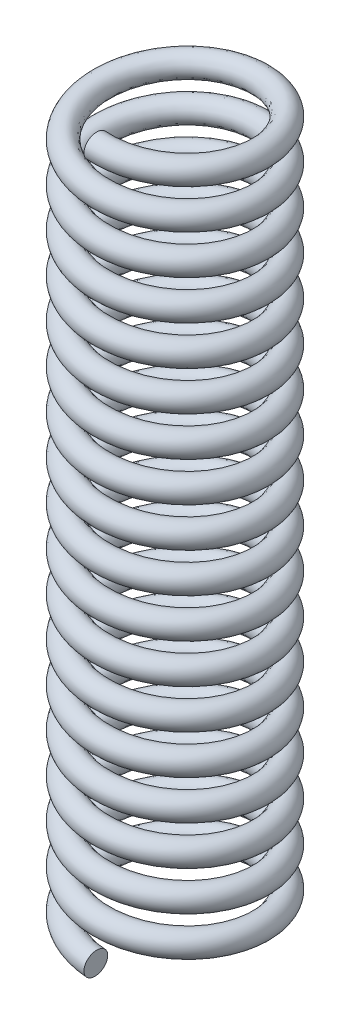
from build123d import *

# Parameters (mm, degrees)
COIL_WIRE_PITCH     = 1.988888889
COIL_WIRE_HEIGHT    = 35.8
COIL_WIRE_RADIUS    = 4
COIL_WIRE_PROFILE_R = 0.6


with BuildPart() as part:
    # Coil_Wire: sweep along a helix
    with BuildLine() as coil_wire_path:
        Helix(COIL_WIRE_PITCH, COIL_WIRE_HEIGHT, COIL_WIRE_RADIUS, center=(0, 0, 0), direction=(0, 1, 0), lefthand=True)
    # Coil_Wire profile (on start of the path) → Coil_Wire (sweep)
    with BuildSketch(Plane(origin=(0, 0, 4), x_dir=(-0.07888874327688138, -0.9968834265771472, 0), z_dir=(-0.9968834265771472, 0.07888874327688138, 9.270693977429093e-14))):
        Circle(COIL_WIRE_PROFILE_R)
    sweep(path=coil_wire_path.line, is_frenet=True)


solid = part.part
